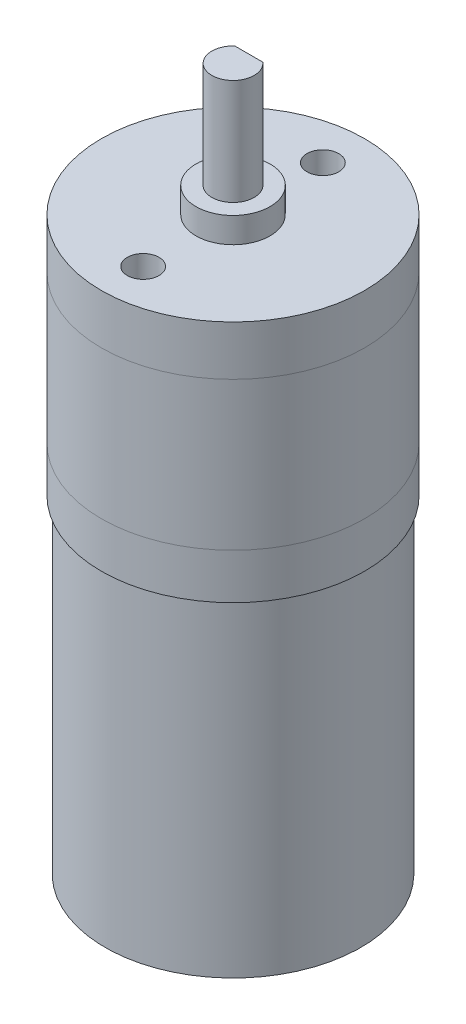
from build123d import *
from build123d.topology import SkipClean

# Parameters (mm, degrees)
EXTRUDE_1_DEPTH     = 8
SKETCH_3_R          = 2
EXTRUDE_2_DEPTH     = 2
SKETCH_4_R          = 3.5
EXTRUDE_3_DEPTH     = 2.4
SKETCH_5_R          = 12.45
EXTRUDE_4_DEPTH     = 4.7
SKETCH_6_R          = 12.4495
EXTRUDE_5_DEPTH     = 14
SKETCH_7_R          = 12.45
EXTRUDE_6_DEPTH     = 4.3
SKETCH_8_R          = 12.1
EXTRUDE_7_DEPTH     = 31
SKETCH_9_R          = 11.6
CUT_EXTRUDE_3_DEPTH = 1
SKETCH_10_R         = 3
EXTRUDE_8_DEPTH     = 2
FILLET_1_R          = 1
SKETCH_11_R         = 1.5
CUT_EXTRUDE_4_DEPTH = 7


with BuildPart() as part:
    # Эскиз2 → Бобышка-Вытянуть1 (new body)
    with BuildSketch(Plane(origin=(0, 0, 0), x_dir=(1, 0, 0), z_dir=(0, 1, 0))):
        with BuildLine():
            Line((1.322875656, 1.5), (-1.322875656, 1.5))
            ThreePointArc((-1.322875656, 1.5), (-0.822875656, -1.822875656), (2, 0))
            ThreePointArc((2, 0), (1.822875656, 0.822875656), (1.322875656, 1.5))
        make_face()
    extrude(amount=-EXTRUDE_1_DEPTH)

    # Эскиз3 → Бобышка-Вытянуть2 (add)
    with BuildSketch(Plane(origin=(0, -8, 0), x_dir=(-1, 0, 0), z_dir=(0, -1, 0))):
        with Locations(Location((0, 0, 0), (0, 0, 48.590377891))):
            Circle(SKETCH_3_R)
    extrude(amount=EXTRUDE_2_DEPTH)

    # Эскиз4 → Бобышка-Вытянуть3 (add)
    with SkipClean():  # the faces are left unmerged after this step: merging them gives an invalid solid
        with BuildSketch(Plane(origin=(0, -10, 0), x_dir=(-1, 0, 0), z_dir=(0, -1, 0))):
            with Locations(Location((0, 0, 0), (0, 0, 90))):
                Circle(SKETCH_4_R)
        extrude(amount=EXTRUDE_3_DEPTH)

    # Эскиз5 → Бобышка-Вытянуть4 (add)
    with SkipClean():  # the faces are left unmerged after this step: merging them gives an invalid solid
        with BuildSketch(Plane(origin=(0, -12.4, 0), x_dir=(-1, 0, 0), z_dir=(0, -1, 0))):
            with Locations(Location((0, 0, 0), (0, 0, 90))):
                Circle(SKETCH_5_R)
        extrude(amount=EXTRUDE_4_DEPTH)

    # Эскиз6 → Бобышка-Вытянуть5 (add)
    with SkipClean():  # the faces are left unmerged after this step: merging them gives an invalid solid
        with BuildSketch(Plane(origin=(0, -17.1, 0), x_dir=(-1, 0, 0), z_dir=(0, -1, 0))):
            with Locations(Location((0, 0, 0), (0, 0, 90))):
                Circle(SKETCH_6_R)
        extrude(amount=EXTRUDE_5_DEPTH)

    # Эскиз7 → Бобышка-Вытянуть6 (add)
    with SkipClean():  # the faces are left unmerged after this step: merging them gives an invalid solid
        with BuildSketch(Plane(origin=(0, -31.1, 0), x_dir=(-1, 0, 0), z_dir=(0, -1, 0))):
            with Locations(Location((0, 0, 0), (0, 0, 90))):
                Circle(SKETCH_7_R)
        extrude(amount=EXTRUDE_6_DEPTH)

    # Эскиз8 → Бобышка-Вытянуть7 (add)
    with SkipClean():  # the faces are left unmerged after this step: merging them gives an invalid solid
        with BuildSketch(Plane(origin=(0, -35.4, 0), x_dir=(-1, 0, 0), z_dir=(0, -1, 0))):
            with Locations(Location((0, 0, 0), (0, 0, 90))):
                Circle(SKETCH_8_R)
        extrude(amount=EXTRUDE_7_DEPTH)

    # Эскиз9 → Вырез-Вытянуть3 (cut)
    with SkipClean():  # the faces are left unmerged after this step: merging them gives an invalid solid
        with BuildSketch(Plane(origin=(0, -66.4, 0), x_dir=(-1, 0, 0), z_dir=(0, -1, 0))):
            with Locations(Location((0, 0, 0), (0, 0, 90))):
                Circle(SKETCH_9_R)
        extrude(amount=-CUT_EXTRUDE_3_DEPTH, mode=Mode.SUBTRACT)

    # Эскиз10 → Бобышка-Вытянуть8 (add)
    with SkipClean():  # the faces are left unmerged after this step: merging them gives an invalid solid
        with BuildSketch(Plane(origin=(0, -65.4, 0), x_dir=(-1, 0, 0), z_dir=(0, -1, 0))):
            with Locations(Location((0, 0, 0), (0, 0, 90))):
                Circle(SKETCH_10_R)
        extrude(amount=EXTRUDE_8_DEPTH)

    # Скругление1
    fillet_1_edges = [part.edges().sort_by_distance(p)[0] for p in [
        (0, -67.4, 3),
    ]]
    fillet(fillet_1_edges, radius=FILLET_1_R)

    # Эскиз11 → Вырез-Вытянуть4 (cut)
    with SkipClean():  # the faces are left unmerged after this step: merging them gives an invalid solid
        with BuildSketch(Plane(origin=(0, -12.4, 0), x_dir=(1, 0, 0), z_dir=(0, 1, 0))):
            with Locations(Location((0, 8.5, 0), (0, 0, 270))):
                Circle(SKETCH_11_R)
            with Locations(Location((0, -8.5, 0), (0, 0, 270))):
                Circle(SKETCH_11_R)
        extrude(amount=-CUT_EXTRUDE_4_DEPTH, mode=Mode.SUBTRACT)


solid = part.part
